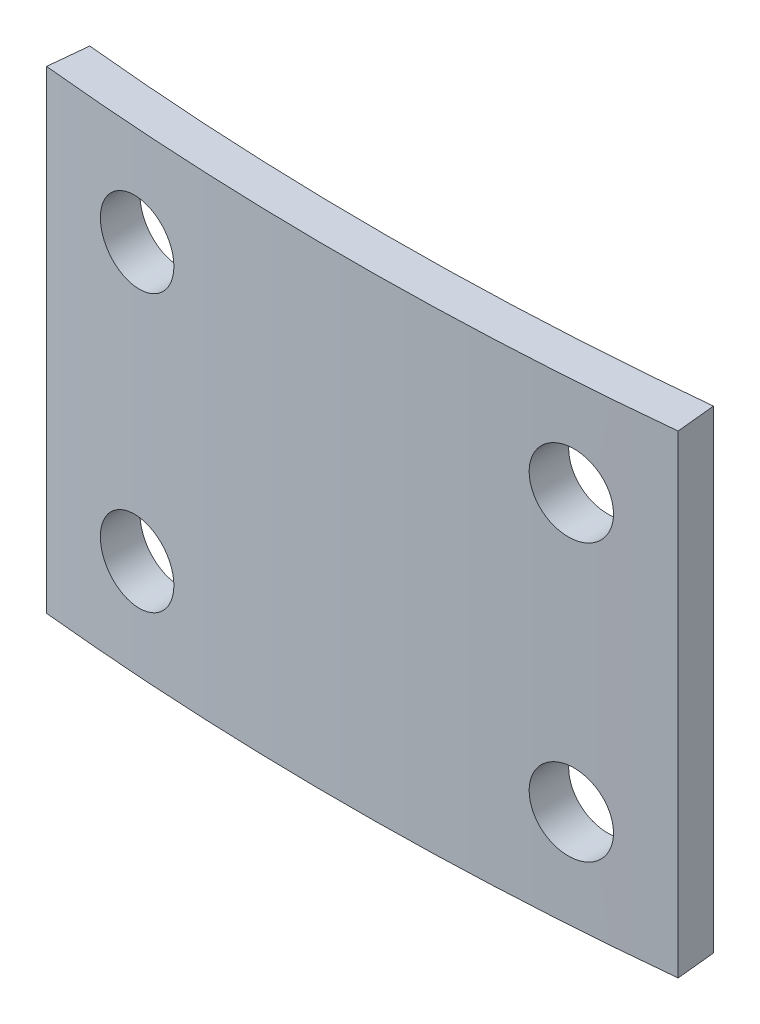
from build123d import *

# Parameters (mm, degrees)
BOSS_EXTRUDE1_DEPTH     = 120
CUT_EXTRUDE1_DEPTH      = 805.366061409
CUT_EXTRUDE1_DEPTH_BACK = 805.366061409
SKETCH2_R               = 10


with BuildPart() as part:
    # Sketch1 → Boss-Extrude1 (new body)
    with BuildSketch(Plane(origin=(0, 0, 0), x_dir=(1, 0, 0), z_dir=(0, 1, 0))):
        with BuildLine():
            Line((103.980664092, -784.528333178), (102.980664092, -774.578458807))
            ThreePointArc((102.980664092, -774.578458807), (23.980664092, -778.538383493), (-55.019335908, -774.578458807))
            Line((-55.019335908, -774.578458807), (-56.019335908, -784.528333178))
            ThreePointArc((-56.019335908, -784.528333178), (23.980664092, -788.538383493), (103.980664092, -784.528333178))
        make_face()
    extrude(amount=BOSS_EXTRUDE1_DEPTH)

    # Sketch2 → Cut-Extrude1 (cut, two sides: drawn at the far end of the back side and taken through both)
    with BuildSketch(Plane.XY.offset(-CUT_EXTRUDE1_DEPTH_BACK)):
        with Locations(Location((-31.019335908, 95, 0), (0, 0, 180))):
            Circle(SKETCH2_R)
        with Locations(Location((78.980664092, 95, 0), (0, 0, 180))):
            Circle(SKETCH2_R)
        with Locations(Location((78.980664092, 25, 0), (0, 0, 180))):
            Circle(SKETCH2_R)
        with Locations(Location((-31.019335908, 25, 0), (0, 0, 180))):
            Circle(SKETCH2_R)
    extrude(amount=CUT_EXTRUDE1_DEPTH + CUT_EXTRUDE1_DEPTH_BACK, mode=Mode.SUBTRACT)


solid = part.part
